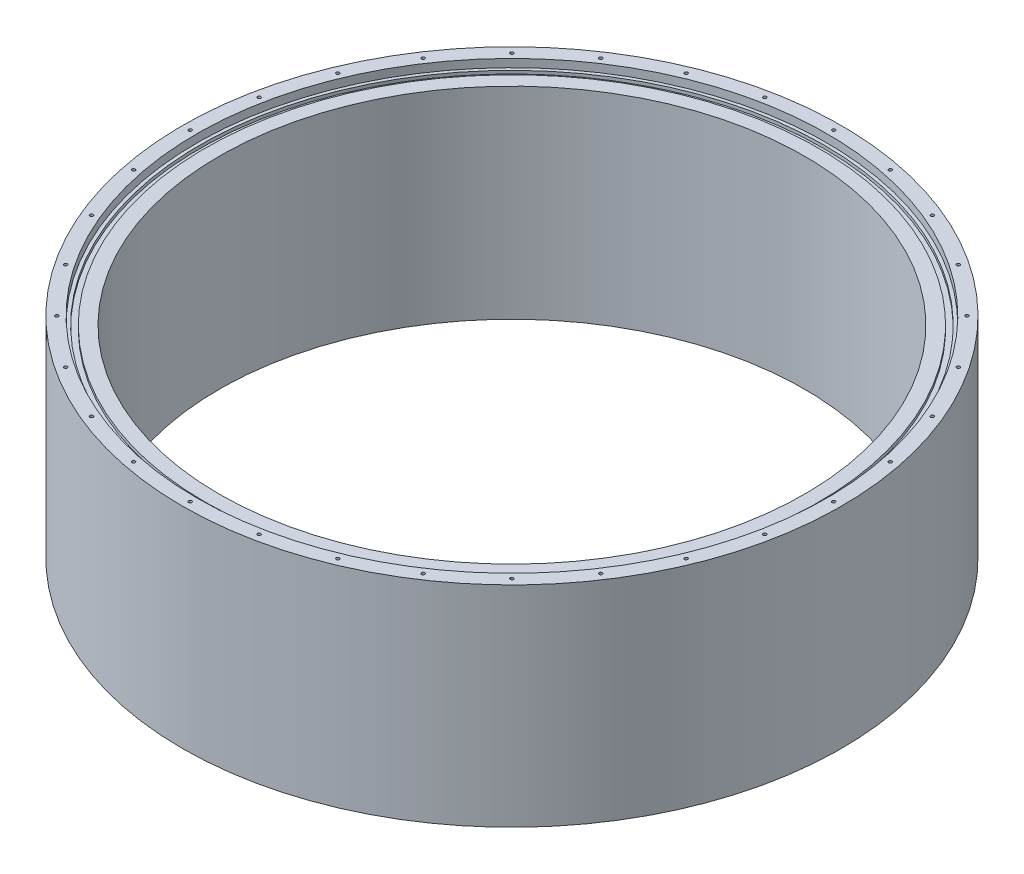
from build123d import *

# Parameters (mm, degrees)
SKETCH2_W                 = 4.1656
SKETCH2_H                 = 2.413
CIRPATTERN1_COUNT         = 32
F_5_0MM_DOWEL_HOLE1_D     = 5.05
F_5_0MM_DOWEL_HOLE1_DEPTH = 19.5
F_5_0MM_DOWEL_HOLE1_TIP   = 1.517173063


with BuildPart() as part:
    # Sketch1 → Revolve1 (revolve)
    with BuildSketch(Plane.XY, mode=Mode.PRIVATE) as revolve1_sk:
        Polygon((225.6, 74.685), (243, 74.685), (243, 80.885), (254, 80.885), (254, -80.885), (225.6, -80.885), align=None)
    revolve(revolve1_sk.sketch.rotate(Axis((0, 80.885, 0), (0, -1, 0)), 90), axis=Axis((0, 80.885, 0), (0, -1, 0)))

    # Sketch2 → Cut-Revolve1 (revolve, cut)
    with BuildSketch(Plane.XY, mode=Mode.PRIVATE) as cut_revolve1_sk:
        with Locations((238.4172, 73.4785)):
            Rectangle(SKETCH2_W, SKETCH2_H)
    revolve(cut_revolve1_sk.sketch.rotate(Axis((0, 80.885, 0), (0, -1, 0)), 90), axis=Axis((0, 80.885, 0), (0, -1, 0)), mode=Mode.SUBTRACT)

    # Sketch4 → M3x0.5 Tapped Hole1 (revolve, cut)
    with BuildSketch(Plane(origin=(248, 80.885, 0), x_dir=(0, 0, 1), z_dir=(1, 0, 0))):
        Polygon((0, 0), (0, 10.251075774), (1.25, 9.5), (1.25, 0), align=None)
    m3x0_5_tapped_hole1 = revolve(axis=Axis((248, 87.235, 0), (0, -1, 0)), mode=Mode.SUBTRACT)

    # CirPattern1: M3x0.5 Tapped Hole1 ×32 about axis
    cirpattern1_axis = Axis((0, 0, 0), (0, 1, 0))
    for i in range(1, CIRPATTERN1_COUNT):
        add(m3x0_5_tapped_hole1.rotate(cirpattern1_axis, i * 360 / CIRPATTERN1_COUNT), mode=Mode.SUBTRACT)

    # Mirror1: M3x0.5 Tapped Hole1 across plane
    add(m3x0_5_tapped_hole1.mirror(Plane.ZX), mode=Mode.SUBTRACT)

    # Mirror1 copy 1 sketch → Mirror1 copy 1 (revolve, cut)
    with BuildSketch(Plane(origin=(243.23474954, -80.885, -48.38239986), x_dir=(0.19509032201612825, 0, 0.9807852804032304), z_dir=(0.9807852804032304, 0, -0.19509032201612825))):
        Polygon((0, 0), (0, -10.251075774), (1.25, -9.5), (1.25, 0), align=None)
    revolve(axis=Axis((243.23474954, -87.235, -48.38239986), (0, -1, 0)), mode=Mode.SUBTRACT)

    # Mirror1 copy 2 sketch → Mirror1 copy 2 (revolve, cut)
    with BuildSketch(Plane(origin=(229.122124063, -80.885, -94.905491227), x_dir=(0.3826834323650898, 0, 0.9238795325112867), z_dir=(0.9238795325112867, 0, -0.3826834323650898))):
        Polygon((0, 0), (0, -10.251075774), (1.25, -9.5), (1.25, 0), align=None)
    revolve(axis=Axis((229.122124063, -87.235, -94.905491227), (0, -1, 0)), mode=Mode.SUBTRACT)

    # Mirror1 copy 3 sketch → Mirror1 copy 3 (revolve, cut)
    with BuildSketch(Plane(origin=(206.204463851, -80.885, -137.781417789), x_dir=(0.5555702330196022, 0, 0.8314696123025452), z_dir=(0.8314696123025452, 0, -0.5555702330196022))):
        Polygon((0, 0), (0, -10.251075774), (1.25, -9.5), (1.25, 0), align=None)
    revolve(axis=Axis((206.204463851, -87.235, -137.781417789), (0, -1, 0)), mode=Mode.SUBTRACT)

    # Mirror1 copy 4 sketch → Mirror1 copy 4 (revolve, cut)
    with BuildSketch(Plane(origin=(175.362481734, -80.885, -175.362481734), x_dir=(0.7071067811865475, 0, 0.7071067811865476), z_dir=(0.7071067811865476, 0, -0.7071067811865475))):
        Polygon((0, 0), (0, -10.251075774), (1.25, -9.5), (1.25, 0), align=None)
    revolve(axis=Axis((175.362481734, -87.235, -175.362481734), (0, -1, 0)), mode=Mode.SUBTRACT)

    # Mirror1 copy 5 sketch → Mirror1 copy 5 (revolve, cut)
    with BuildSketch(Plane(origin=(137.781417789, -80.885, -206.204463851), x_dir=(0.8314696123025452, 0, 0.5555702330196023), z_dir=(0.5555702330196023, 0, -0.8314696123025452))):
        Polygon((0, 0), (0, -10.251075774), (1.25, -9.5), (1.25, 0), align=None)
    revolve(axis=Axis((137.781417789, -87.235, -206.204463851), (0, -1, 0)), mode=Mode.SUBTRACT)

    # Mirror1 copy 6 sketch → Mirror1 copy 6 (revolve, cut)
    with BuildSketch(Plane(origin=(94.905491227, -80.885, -229.122124063), x_dir=(0.9238795325112867, 0, 0.38268343236508984), z_dir=(0.38268343236508984, 0, -0.9238795325112867))):
        Polygon((0, 0), (0, -10.251075774), (1.25, -9.5), (1.25, 0), align=None)
    revolve(axis=Axis((94.905491227, -87.235, -229.122124063), (0, -1, 0)), mode=Mode.SUBTRACT)

    # Mirror1 copy 7 sketch → Mirror1 copy 7 (revolve, cut)
    with BuildSketch(Plane(origin=(48.38239986, -80.885, -243.23474954), x_dir=(0.9807852804032304, 0, 0.19509032201612833), z_dir=(0.19509032201612833, 0, -0.9807852804032304))):
        Polygon((0, 0), (0, -10.251075774), (1.25, -9.5), (1.25, 0), align=None)
    revolve(axis=Axis((48.38239986, -87.235, -243.23474954), (0, -1, 0)), mode=Mode.SUBTRACT)

    # Mirror1 copy 8 sketch → Mirror1 copy 8 (revolve, cut)
    with BuildSketch(Plane(origin=(0, -80.885, -248), x_dir=(1, 0, 0), z_dir=(0, 0, -1))):
        Polygon((0, 0), (0, -10.251075774), (1.25, -9.5), (1.25, 0), align=None)
    revolve(axis=Axis((0, -87.235, -248), (0, -1, 0)), mode=Mode.SUBTRACT)

    # Mirror1 copy 9 sketch → Mirror1 copy 9 (revolve, cut)
    with BuildSketch(Plane(origin=(-48.38239986, -80.885, -243.23474954), x_dir=(0.9807852804032304, 0, -0.1950903220161282), z_dir=(-0.1950903220161282, 0, -0.9807852804032304))):
        Polygon((0, 0), (0, -10.251075774), (1.25, -9.5), (1.25, 0), align=None)
    revolve(axis=Axis((-48.38239986, -87.235, -243.23474954), (0, -1, 0)), mode=Mode.SUBTRACT)

    # Mirror1 copy 10 sketch → Mirror1 copy 10 (revolve, cut)
    with BuildSketch(Plane(origin=(-94.905491227, -80.885, -229.122124063), x_dir=(0.9238795325112867, 0, -0.3826834323650897), z_dir=(-0.3826834323650897, 0, -0.9238795325112867))):
        Polygon((0, 0), (0, -10.251075774), (1.25, -9.5), (1.25, 0), align=None)
    revolve(axis=Axis((-94.905491227, -87.235, -229.122124063), (0, -1, 0)), mode=Mode.SUBTRACT)

    # Mirror1 copy 11 sketch → Mirror1 copy 11 (revolve, cut)
    with BuildSketch(Plane(origin=(-137.781417789, -80.885, -206.204463851), x_dir=(0.8314696123025451, 0, -0.5555702330196023), z_dir=(-0.5555702330196023, 0, -0.8314696123025451))):
        Polygon((0, 0), (0, -10.251075774), (1.25, -9.5), (1.25, 0), align=None)
    revolve(axis=Axis((-137.781417789, -87.235, -206.204463851), (0, -1, 0)), mode=Mode.SUBTRACT)

    # Mirror1 copy 12 sketch → Mirror1 copy 12 (revolve, cut)
    with BuildSketch(Plane(origin=(-175.362481734, -80.885, -175.362481734), x_dir=(0.7071067811865476, 0, -0.7071067811865475), z_dir=(-0.7071067811865475, 0, -0.7071067811865476))):
        Polygon((0, 0), (0, -10.251075774), (1.25, -9.5), (1.25, 0), align=None)
    revolve(axis=Axis((-175.362481734, -87.235, -175.362481734), (0, -1, 0)), mode=Mode.SUBTRACT)

    # Mirror1 copy 13 sketch → Mirror1 copy 13 (revolve, cut)
    with BuildSketch(Plane(origin=(-206.204463851, -80.885, -137.781417789), x_dir=(0.5555702330196022, 0, -0.8314696123025453), z_dir=(-0.8314696123025453, 0, -0.5555702330196022))):
        Polygon((0, 0), (0, -10.251075774), (1.25, -9.5), (1.25, 0), align=None)
    revolve(axis=Axis((-206.204463851, -87.235, -137.781417789), (0, -1, 0)), mode=Mode.SUBTRACT)

    # Mirror1 copy 14 sketch → Mirror1 copy 14 (revolve, cut)
    with BuildSketch(Plane(origin=(-229.122124063, -80.885, -94.905491227), x_dir=(0.3826834323650899, 0, -0.9238795325112867), z_dir=(-0.9238795325112867, 0, -0.3826834323650899))):
        Polygon((0, 0), (0, -10.251075774), (1.25, -9.5), (1.25, 0), align=None)
    revolve(axis=Axis((-229.122124063, -87.235, -94.905491227), (0, -1, 0)), mode=Mode.SUBTRACT)

    # Mirror1 copy 15 sketch → Mirror1 copy 15 (revolve, cut)
    with BuildSketch(Plane(origin=(-243.23474954, -80.885, -48.38239986), x_dir=(0.19509032201612816, 0, -0.9807852804032304), z_dir=(-0.9807852804032304, 0, -0.19509032201612816))):
        Polygon((0, 0), (0, -10.251075774), (1.25, -9.5), (1.25, 0), align=None)
    revolve(axis=Axis((-243.23474954, -87.235, -48.38239986), (0, -1, 0)), mode=Mode.SUBTRACT)

    # Mirror1 copy 16 sketch → Mirror1 copy 16 (revolve, cut)
    with BuildSketch(Plane(origin=(-248, -80.885, 0), x_dir=(0, 0, -1), z_dir=(-1, 0, 0))):
        Polygon((0, 0), (0, -10.251075774), (1.25, -9.5), (1.25, 0), align=None)
    revolve(axis=Axis((-248, -87.235, 0), (0, -1, 0)), mode=Mode.SUBTRACT)

    # Mirror1 copy 17 sketch → Mirror1 copy 17 (revolve, cut)
    with BuildSketch(Plane(origin=(-243.23474954, -80.885, 48.38239986), x_dir=(-0.19509032201612836, 0, -0.9807852804032304), z_dir=(-0.9807852804032304, 0, 0.19509032201612836))):
        Polygon((0, 0), (0, -10.251075774), (1.25, -9.5), (1.25, 0), align=None)
    revolve(axis=Axis((-243.23474954, -87.235, 48.38239986), (0, -1, 0)), mode=Mode.SUBTRACT)

    # Mirror1 copy 18 sketch → Mirror1 copy 18 (revolve, cut)
    with BuildSketch(Plane(origin=(-229.122124063, -80.885, 94.905491227), x_dir=(-0.38268343236508967, 0, -0.9238795325112868), z_dir=(-0.9238795325112868, 0, 0.38268343236508967))):
        Polygon((0, 0), (0, -10.251075774), (1.25, -9.5), (1.25, 0), align=None)
    revolve(axis=Axis((-229.122124063, -87.235, 94.905491227), (0, -1, 0)), mode=Mode.SUBTRACT)

    # Mirror1 copy 19 sketch → Mirror1 copy 19 (revolve, cut)
    with BuildSketch(Plane(origin=(-206.204463851, -80.885, 137.781417789), x_dir=(-0.5555702330196023, 0, -0.8314696123025452), z_dir=(-0.8314696123025452, 0, 0.5555702330196023))):
        Polygon((0, 0), (0, -10.251075774), (1.25, -9.5), (1.25, 0), align=None)
    revolve(axis=Axis((-206.204463851, -87.235, 137.781417789), (0, -1, 0)), mode=Mode.SUBTRACT)

    # Mirror1 copy 20 sketch → Mirror1 copy 20 (revolve, cut)
    with BuildSketch(Plane(origin=(-175.362481734, -80.885, 175.362481734), x_dir=(-0.7071067811865475, 0, -0.7071067811865477), z_dir=(-0.7071067811865477, 0, 0.7071067811865475))):
        Polygon((0, 0), (0, -10.251075774), (1.25, -9.5), (1.25, 0), align=None)
    revolve(axis=Axis((-175.362481734, -87.235, 175.362481734), (0, -1, 0)), mode=Mode.SUBTRACT)

    # Mirror1 copy 21 sketch → Mirror1 copy 21 (revolve, cut)
    with BuildSketch(Plane(origin=(-137.781417789, -80.885, 206.204463851), x_dir=(-0.8314696123025452, 0, -0.5555702330196022), z_dir=(-0.5555702330196022, 0, 0.8314696123025452))):
        Polygon((0, 0), (0, -10.251075774), (1.25, -9.5), (1.25, 0), align=None)
    revolve(axis=Axis((-137.781417789, -87.235, 206.204463851), (0, -1, 0)), mode=Mode.SUBTRACT)

    # Mirror1 copy 22 sketch → Mirror1 copy 22 (revolve, cut)
    with BuildSketch(Plane(origin=(-94.905491227, -80.885, 229.122124063), x_dir=(-0.9238795325112868, 0, -0.3826834323650895), z_dir=(-0.3826834323650895, 0, 0.9238795325112868))):
        Polygon((0, 0), (0, -10.251075774), (1.25, -9.5), (1.25, 0), align=None)
    revolve(axis=Axis((-94.905491227, -87.235, 229.122124063), (0, -1, 0)), mode=Mode.SUBTRACT)

    # Mirror1 copy 23 sketch → Mirror1 copy 23 (revolve, cut)
    with BuildSketch(Plane(origin=(-48.38239986, -80.885, 243.23474954), x_dir=(-0.9807852804032303, 0, -0.19509032201612866), z_dir=(-0.19509032201612866, 0, 0.9807852804032303))):
        Polygon((0, 0), (0, -10.251075774), (1.25, -9.5), (1.25, 0), align=None)
    revolve(axis=Axis((-48.38239986, -87.235, 243.23474954), (0, -1, 0)), mode=Mode.SUBTRACT)

    # Mirror1 copy 24 sketch → Mirror1 copy 24 (revolve, cut)
    with BuildSketch(Plane(origin=(0, -80.885, 248), x_dir=(-1, 0, 0), z_dir=(0, 0, 1))):
        Polygon((0, 0), (0, -10.251075774), (1.25, -9.5), (1.25, 0), align=None)
    revolve(axis=Axis((0, -87.235, 248), (0, -1, 0)), mode=Mode.SUBTRACT)

    # Mirror1 copy 25 sketch → Mirror1 copy 25 (revolve, cut)
    with BuildSketch(Plane(origin=(48.38239986, -80.885, 243.23474954), x_dir=(-0.9807852804032304, 0, 0.1950903220161283), z_dir=(0.1950903220161283, 0, 0.9807852804032304))):
        Polygon((0, 0), (0, -10.251075774), (1.25, -9.5), (1.25, 0), align=None)
    revolve(axis=Axis((48.38239986, -87.235, 243.23474954), (0, -1, 0)), mode=Mode.SUBTRACT)

    # Mirror1 copy 26 sketch → Mirror1 copy 26 (revolve, cut)
    with BuildSketch(Plane(origin=(94.905491227, -80.885, 229.122124063), x_dir=(-0.9238795325112866, 0, 0.38268343236509), z_dir=(0.38268343236509, 0, 0.9238795325112866))):
        Polygon((0, 0), (0, -10.251075774), (1.25, -9.5), (1.25, 0), align=None)
    revolve(axis=Axis((94.905491227, -87.235, 229.122124063), (0, -1, 0)), mode=Mode.SUBTRACT)

    # Mirror1 copy 27 sketch → Mirror1 copy 27 (revolve, cut)
    with BuildSketch(Plane(origin=(137.781417789, -80.885, 206.204463851), x_dir=(-0.8314696123025455, 0, 0.5555702330196018), z_dir=(0.5555702330196018, 0, 0.8314696123025455))):
        Polygon((0, 0), (0, -10.251075774), (1.25, -9.5), (1.25, 0), align=None)
    revolve(axis=Axis((137.781417789, -87.235, 206.204463851), (0, -1, 0)), mode=Mode.SUBTRACT)

    # Mirror1 copy 28 sketch → Mirror1 copy 28 (revolve, cut)
    with BuildSketch(Plane(origin=(175.362481734, -80.885, 175.362481734), x_dir=(-0.7071067811865477, 0, 0.7071067811865474), z_dir=(0.7071067811865474, 0, 0.7071067811865477))):
        Polygon((0, 0), (0, -10.251075774), (1.25, -9.5), (1.25, 0), align=None)
    revolve(axis=Axis((175.362481734, -87.235, 175.362481734), (0, -1, 0)), mode=Mode.SUBTRACT)

    # Mirror1 copy 29 sketch → Mirror1 copy 29 (revolve, cut)
    with BuildSketch(Plane(origin=(206.204463851, -80.885, 137.781417789), x_dir=(-0.5555702330196022, 0, 0.8314696123025452), z_dir=(0.8314696123025452, 0, 0.5555702330196022))):
        Polygon((0, 0), (0, -10.251075774), (1.25, -9.5), (1.25, 0), align=None)
    revolve(axis=Axis((206.204463851, -87.235, 137.781417789), (0, -1, 0)), mode=Mode.SUBTRACT)

    # Mirror1 copy 30 sketch → Mirror1 copy 30 (revolve, cut)
    with BuildSketch(Plane(origin=(229.122124063, -80.885, 94.905491227), x_dir=(-0.38268343236508956, 0, 0.9238795325112868), z_dir=(0.9238795325112868, 0, 0.38268343236508956))):
        Polygon((0, 0), (0, -10.251075774), (1.25, -9.5), (1.25, 0), align=None)
    revolve(axis=Axis((229.122124063, -87.235, 94.905491227), (0, -1, 0)), mode=Mode.SUBTRACT)

    # Mirror1 copy 31 sketch → Mirror1 copy 31 (revolve, cut)
    with BuildSketch(Plane(origin=(243.23474954, -80.885, 48.38239986), x_dir=(-0.19509032201612872, 0, 0.9807852804032303), z_dir=(0.9807852804032303, 0, 0.19509032201612872))):
        Polygon((0, 0), (0, -10.251075774), (1.25, -9.5), (1.25, 0), align=None)
    revolve(axis=Axis((243.23474954, -87.235, 48.38239986), (0, -1, 0)), mode=Mode.SUBTRACT)

    # Ø5.0mm Dowel Hole1
    with Locations(Plane(origin=(0, -80.885, 0), x_dir=(-1, 0, 0), z_dir=(0, -1, 0))):
        with Locations((24.210233661, -245.810627488), (-24.210233661, 245.810627488)):
            Hole(F_5_0MM_DOWEL_HOLE1_D / 2, depth=F_5_0MM_DOWEL_HOLE1_DEPTH)
            with Locations((0, 0, -(F_5_0MM_DOWEL_HOLE1_DEPTH + F_5_0MM_DOWEL_HOLE1_TIP / 2))):  # 118° drill point
                Cone(0, F_5_0MM_DOWEL_HOLE1_D / 2, F_5_0MM_DOWEL_HOLE1_TIP, mode=Mode.SUBTRACT)


solid = part.part
